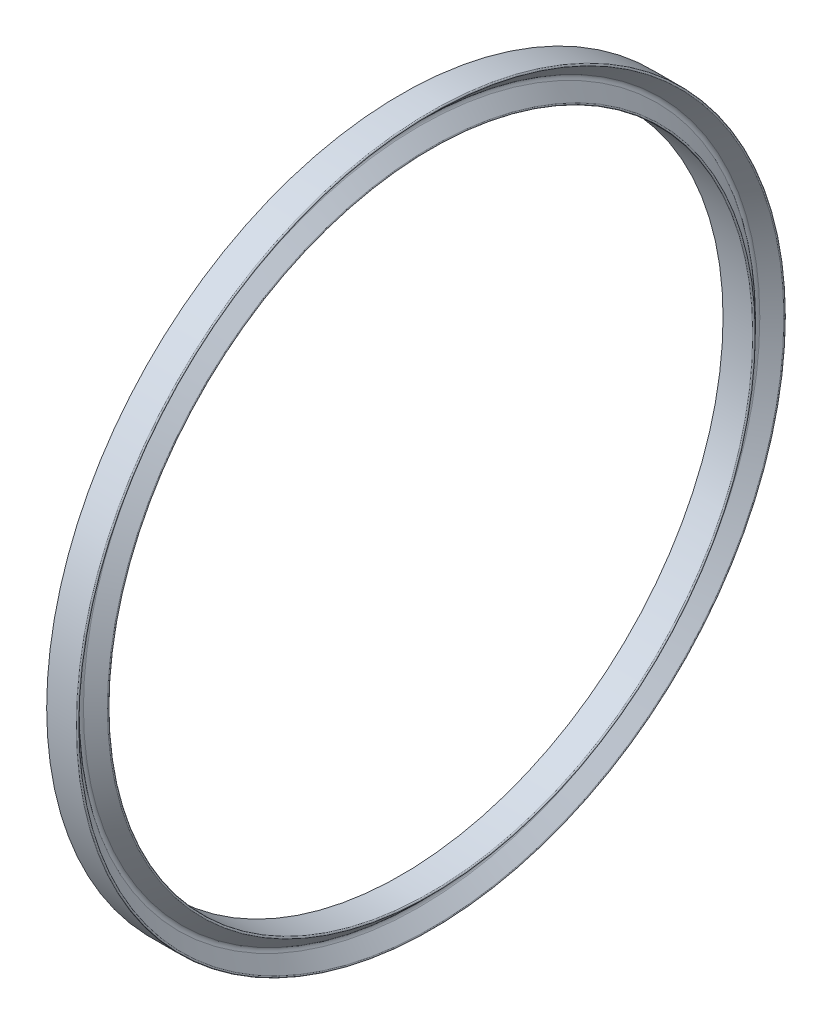
from build123d import *


with BuildPart() as part:
    # Sketch1 → Revolve1 (revolve)
    with BuildSketch(Plane.XY, mode=Mode.PRIVATE) as revolve1_sk:
        with BuildLine():
            Line((-58.548165741, -33), (-55.789587097, -33))
            ThreePointArc((-55.789587097, -33), (-55.697199144, -32.938268343), (-55.718876419, -32.829289322))
            Line((-55.718876419, -32.829289322), (-56.836033706, -31.712132034))
            ThreePointArc((-56.836033706, -31.712132034), (-56.923901672, -31.5), (-56.836033706, -31.287867966))
            Line((-56.836033706, -31.287867966), (-55.718876419, -30.170710678))
            ThreePointArc((-55.718876419, -30.170710678), (-55.697199144, -30.061731657), (-55.789587097, -30))
            Line((-55.789587097, -30), (-58.548165741, -30))
            Line((-58.548165741, -30), (-58.548165741, -33))
        make_face()
    revolve(revolve1_sk.sketch.rotate(Axis((-76.324796719, 0, 0), (1, 0, 0)), 270), axis=Axis((-76.324796719, 0, 0), (1, 0, 0)))


solid = part.part
